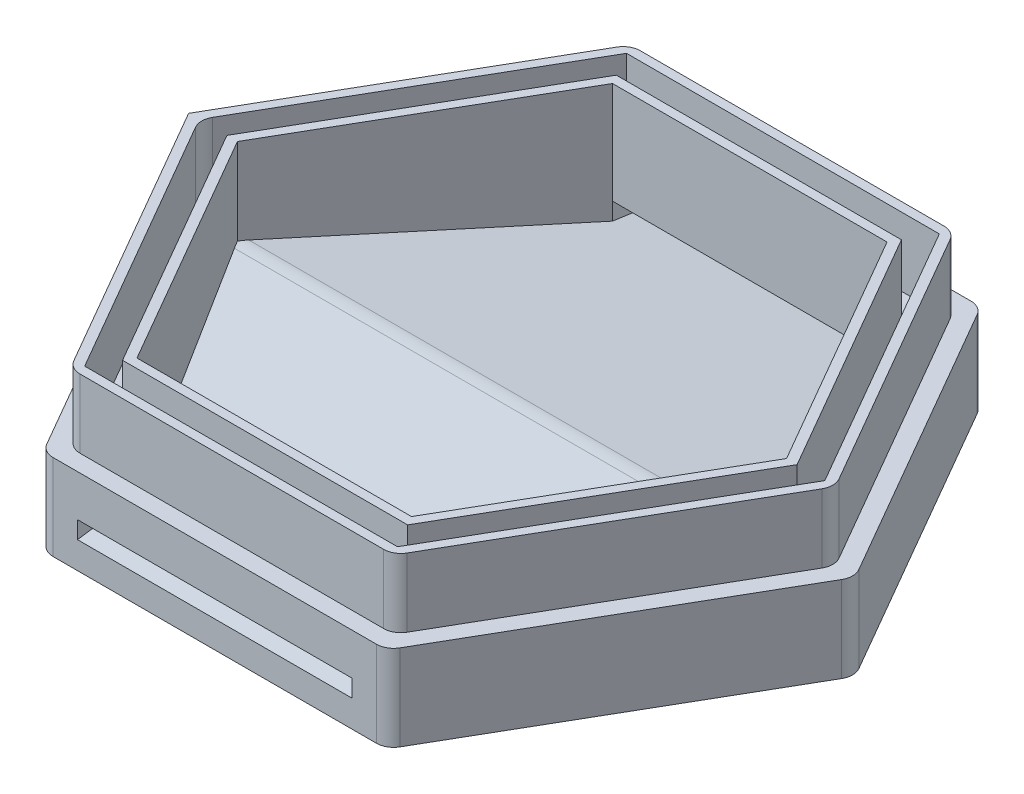
from build123d import *

# Parameters (mm, degrees)
BOSS_EXTRUDE1_DEPTH            = 25
CUT_EXTRUDE1_DEPTH             = 5
CUT_EXTRUDE7_REACH             = 136.629
CUT_EXTRUDE7_DIRECTION_2_REACH = 136.629
CUT_EXTRUDE8_REACH             = 136.629
CUT_EXTRUDE8_DIRECTION_2_REACH = 136.629
CUT_EXTRUDE9_DEPTH             = 40
CUT_EXTRUDE9_DEPTH_BACK        = 40
FILLET2_R                      = 15
BOSS_EXTRUDE5_DEPTH            = 20
FILLET3_R                      = 5


with BuildPart() as part:
    # Sketch1 → Boss-Extrude1 (new body)
    with BuildSketch(Plane(origin=(0, 0, 0), x_dir=(1, 0, 0), z_dir=(0, 1, 0))):
        Polygon((0, 0), (-50, 86.6025403784439), (-149.99999999999997, 86.60254037844393), (-199.99999999999997, 1.041e-14), (-150.00000000000003, -86.60254037844386), (-50.00000000000001, -86.60254037844389), align=None)
    extrude(amount=BOSS_EXTRUDE1_DEPTH)

    # Sketch6 → Cut-Extrude1 (cut)
    with BuildSketch(Plane(origin=(0, 25, 0), x_dir=(1, 0, 0), z_dir=(0, 1, 0))):
        Polygon((-180, 5.476e-14), (-139.99999999999997, -69.28203230275507), (-59.99999999999997, -69.28203230275508), (-20.000000000000004, 1.463e-14), (-60.000000000000014, 69.28203230275516), (-140, 69.28203230275516), align=None)
    extrude(amount=-CUT_EXTRUDE1_DEPTH, mode=Mode.SUBTRACT)

    # Cut-Extrude7: up to this plane
    cut_extrude7_end = Plane(origin=(-20.000000000000004, 20, -1.463e-14), z_dir=(0.8660254037844388, 0, -0.49999999999999983))
    # Sketch21 → Cut-Extrude7 (cut, up to the surface)
    with BuildSketch(Plane(origin=(-100, 0, 0), x_dir=(0, 0, -1), z_dir=(1, 0, 0)), mode=Mode.PRIVATE) as cut_extrude7_sk1:
        Polygon((69.28203230275516, 20), (69.28203230275516, 10.263045350293245), (3.123e-14, 20), align=None)
    cut_extrude7_tool1 = split(extrude(cut_extrude7_sk1.sketch, amount=CUT_EXTRUDE7_REACH, mode=Mode.PRIVATE), bisect_by=cut_extrude7_end, keep=Keep.BOTH, mode=Mode.PRIVATE)
    add(cut_extrude7_tool1.solids().sort_by_distance((-100, 16.754348, -46.188022))[0], mode=Mode.SUBTRACT)

    # Cut-Extrude7 direction 2: up to this plane
    cut_extrude7_direction_2_end = Plane(origin=(-140, 20, -69.28203230275516), z_dir=(-0.8660254037844388, 0, -0.4999999999999998))
    # Sketch21 → Cut-Extrude7 direction 2 (cut, up to the surface)
    with BuildSketch(Plane(origin=(-100, 0, 0), x_dir=(0, 0, -1), z_dir=(1, 0, 0)), mode=Mode.PRIVATE) as cut_extrude7_direction_2_sk1:
        Polygon((69.28203230275516, 20), (69.28203230275516, 10.263045350293245), (3.123e-14, 20), align=None)
    cut_extrude7_direction_2_tool1 = split(extrude(cut_extrude7_direction_2_sk1.sketch, amount=-CUT_EXTRUDE7_DIRECTION_2_REACH, mode=Mode.PRIVATE), bisect_by=cut_extrude7_direction_2_end, keep=Keep.BOTH, mode=Mode.PRIVATE)
    add(cut_extrude7_direction_2_tool1.solids().sort_by_distance((-100, 16.754348, -46.188022))[0], mode=Mode.SUBTRACT)

    # Cut-Extrude8: up to this plane
    cut_extrude8_end = Plane(origin=(-59.99999999999997, 20, 69.28203230275508), z_dir=(0.8660254037844388, 0, 0.49999999999999967))
    # Sketch22 → Cut-Extrude8 (cut, up to the surface)
    with BuildSketch(Plane(origin=(-100, 0, 0), x_dir=(0, 0, -1), z_dir=(1, 0, 0)), mode=Mode.PRIVATE) as cut_extrude8_sk1:
        Polygon((3.123e-14, 20), (-69.28203230275508, 10.26304535029323), (-69.28203230275508, 20), align=None)
    cut_extrude8_tool1 = split(extrude(cut_extrude8_sk1.sketch, amount=CUT_EXTRUDE8_REACH, mode=Mode.PRIVATE), bisect_by=cut_extrude8_end, keep=Keep.BOTH, mode=Mode.PRIVATE)
    add(cut_extrude8_tool1.solids().sort_by_distance((-100, 16.754348, 46.188022))[0], mode=Mode.SUBTRACT)

    # Cut-Extrude8 direction 2: up to this plane
    cut_extrude8_direction_2_end = Plane(origin=(-180, 20, -5.476e-14), z_dir=(-0.8660254037844387, 0, 0.5))
    # Sketch22 → Cut-Extrude8 direction 2 (cut, up to the surface)
    with BuildSketch(Plane(origin=(-100, 0, 0), x_dir=(0, 0, -1), z_dir=(1, 0, 0)), mode=Mode.PRIVATE) as cut_extrude8_direction_2_sk1:
        Polygon((3.123e-14, 20), (-69.28203230275508, 10.26304535029323), (-69.28203230275508, 20), align=None)
    cut_extrude8_direction_2_tool1 = split(extrude(cut_extrude8_direction_2_sk1.sketch, amount=-CUT_EXTRUDE8_DIRECTION_2_REACH, mode=Mode.PRIVATE), bisect_by=cut_extrude8_direction_2_end, keep=Keep.BOTH, mode=Mode.PRIVATE)
    add(cut_extrude8_direction_2_tool1.solids().sort_by_distance((-100, 16.754348, 46.188022))[0], mode=Mode.SUBTRACT)

    # Sketch23 → Cut-Extrude9 (cut, two sides: drawn at the far end of the back side and taken through both)
    with BuildSketch(Plane(origin=(-100, 0, 0), x_dir=(0, 0, -1), z_dir=(1, 0, 0)).offset(-CUT_EXTRUDE9_DEPTH_BACK)):
        Polygon((69.28203230275516, 10.263045350293245), (89.28203230275517, 7.452228656245558), (89.28203230275517, 12.501366518838644), (69.28203230275516, 15.312183212886326), align=None)
        Polygon((-69.28203230275516, 15.312183212886326), (-69.28203230275516, 10.263045350293245), (-89.28203230275517, 7.452228656245558), (-89.28203230275517, 12.501366518838644), align=None)
    extrude(amount=CUT_EXTRUDE9_DEPTH + CUT_EXTRUDE9_DEPTH_BACK, mode=Mode.SUBTRACT)

    # Fillet2
    fillet2_edges = [part.edges().sort_by_distance(p)[0] for p in [
        (-100, 20, -3.347e-14),
    ]]
    fillet(fillet2_edges, radius=FILLET2_R)

    # Sketch27 → Boss-Extrude5 (add)
    # profile 1 of 2: a face of its own
    with BuildSketch(Plane(origin=(0, 25, 0), x_dir=(1, 0, 0), z_dir=(0, 1, 0))):
        Polygon((-147.1132486552964, -81.60254038059946), (-52.8867513447036, -81.60254038059949), (-5.773502689407191, -2.776e-14), (-52.88675134470361, 81.60254038059944), (-147.1132486552964, 81.60254038059945), (-194.22649731059275, -2.775e-14), align=None)
        Polygon((-54.42264973081038, -78.94228634059947), (-8.845299461620776, -2.374e-14), (-54.4226497308104, 78.9422863405995), (-145.57735026918957, 78.9422863405995), (-191.1547005383792, -1.365e-14), (-145.57735026918962, -78.94228634059945), align=None, mode=Mode.SUBTRACT)
    # profile 2 of 2: a face of its own
    with BuildSketch(Plane(origin=(0, 25, 0), x_dir=(1, 0, 0), z_dir=(0, 1, 0))):
        Polygon((-141.5358983848622, -71.94228634059951), (-58.46410161513772, -71.94228634059952), (-16.92820323027549, 1.392e-14), (-58.4641016151377, 71.94228634059947), (-141.53589838486224, 71.94228634059947), (-183.0717967697245, -2.773e-14), align=None)
        Polygon((-139.99999999999997, -69.28203230275507), (-180, 6.939e-14), (-140, 69.28203230275516), (-60.000000000000014, 69.28203230275516), (-20.000000000000004, 1.463e-14), (-59.99999999999997, -69.28203230275508), align=None, mode=Mode.SUBTRACT)
    extrude(amount=BOSS_EXTRUDE5_DEPTH)

    # Fillet3
    fillet3_edges = [part.edges().sort_by_distance(p)[0] for p in [
        (-50.00000000000001, 12.5, 86.60254037844389),
        (-150.00000000000003, 12.5, 86.60254037844386),
        (-147.1132486552964, 35, 81.60254038059946),
        (-199.99999999999997, 12.5, -1.041e-14),
        (-52.8867513447036, 35, 81.60254038059949),
        (-5.773502689407191, 35, 2.776e-14),
        (-149.99999999999997, 12.5, -86.60254037844393),
        (-52.88675134470361, 35, -81.60254038059944),
        (-147.1132486552964, 35, -81.60254038059945),
        (-50, 12.5, -86.6025403784439),
        (0, 12.5, 0),
        (-191.1547005383792, 35, 1.365e-14),
    ]]
    fillet(fillet3_edges, radius=FILLET3_R)


solid = part.part
